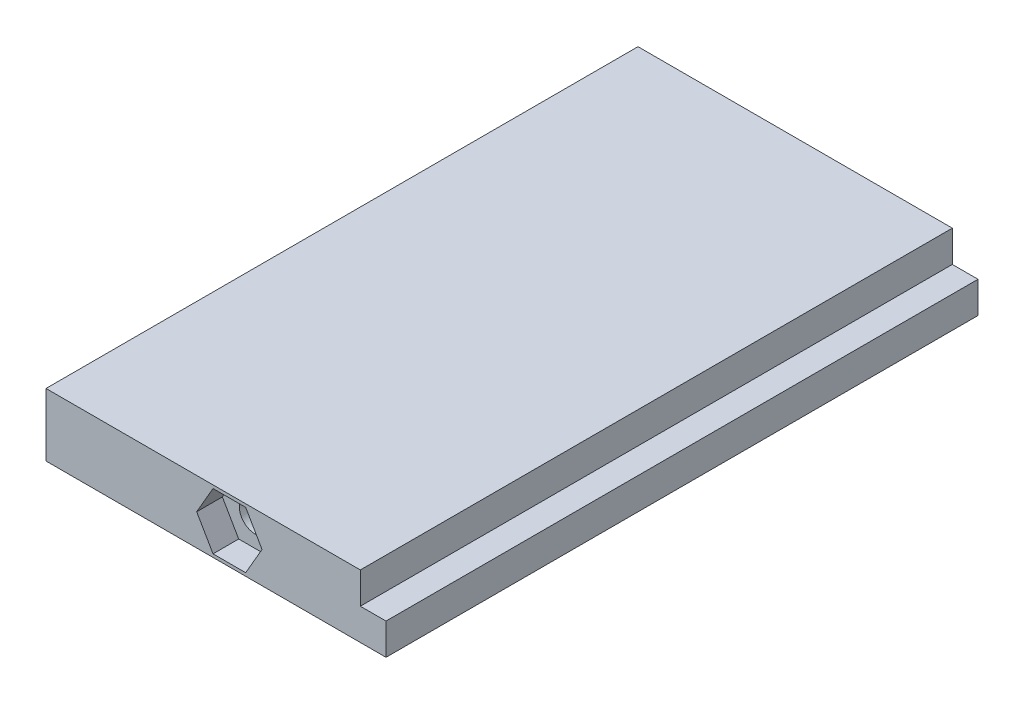
from build123d import *

# Parameters (mm, degrees)
SKETCH1_W           = 30
SKETCH1_H           = 56.5
BOSS_EXTRUDE1_DEPTH = 6
SKETCH8_W           = 56.5
SKETCH8_H           = 3
BOSS_EXTRUDE3_DEPTH = 2.45
SKETCH9_R           = 1.5
CUT_EXTRUDE3_DEPTH  = 60.436962406
CUT_EXTRUDE4_DEPTH  = 2.45


with BuildPart() as part:
    # Sketch1 → Boss-Extrude1 (new body)
    with BuildSketch(Plane(origin=(0, 0, 0), x_dir=(1, 0, 0), z_dir=(0, 1, 0))):
        Rectangle(SKETCH1_W, SKETCH1_H)
    extrude(amount=BOSS_EXTRUDE1_DEPTH)

    # Sketch8 → Boss-Extrude3 (add)
    with BuildSketch(Plane(origin=(15, 0, 0), x_dir=(0, 0, -1), z_dir=(1, 0, 0))):
        with Locations((0, 1.5)):
            Rectangle(SKETCH8_W, SKETCH8_H)
    extrude(amount=BOSS_EXTRUDE3_DEPTH)

    # Sketch9 → Cut-Extrude3 (cut, through all)
    with BuildSketch(Plane(origin=(0, 0, -28.25), x_dir=(-1, 0, 0), z_dir=(0, 0, -1))):
        with Locations((-2.5, 3)):
            Circle(SKETCH9_R)
    extrude(amount=-CUT_EXTRUDE3_DEPTH, mode=Mode.SUBTRACT)

    # Sketch10 → Cut-Extrude4 (cut)
    with BuildSketch(Plane(origin=(0, 0, -28.25), x_dir=(-1, 0, 0), z_dir=(0, 0, -1))):
        Polygon((-0.941154273, 0.3), (0.617691454, 3), (-0.941154273, 5.7), (-4.058845727, 5.7), (-5.617691454, 3), (-4.058845727, 0.3), align=None)
    cut_extrude4 = extrude(amount=-CUT_EXTRUDE4_DEPTH, mode=Mode.SUBTRACT)

    # Mirror2: Cut-Extrude4 across plane
    add(cut_extrude4.mirror(Plane.XY), mode=Mode.SUBTRACT)


solid = part.part
